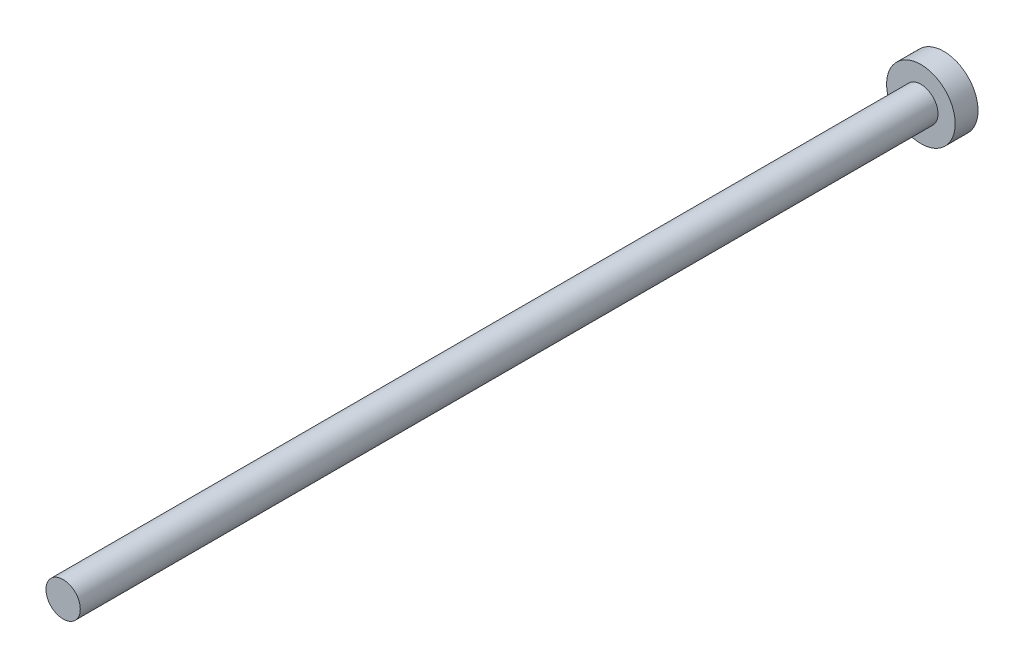
from build123d import *

# Parameters (mm, degrees)
SKETCH1_R           = 1.5
BOSS_EXTRUDE1_DEPTH = 75
SKETCH2_R           = 3
BOSS_EXTRUDE2_DEPTH = 2


with BuildPart() as part:
    # Sketch1 → Boss-Extrude1 (new body)
    with BuildSketch(Plane.XY):
        Circle(SKETCH1_R)
    extrude(amount=BOSS_EXTRUDE1_DEPTH)

    # Sketch2 → Boss-Extrude2 (add)
    with BuildSketch(Plane(origin=(0, 0, 0), x_dir=(-1, 0, 0), z_dir=(0, 0, -1))):
        Circle(SKETCH2_R)
    extrude(amount=BOSS_EXTRUDE2_DEPTH)


solid = part.part
